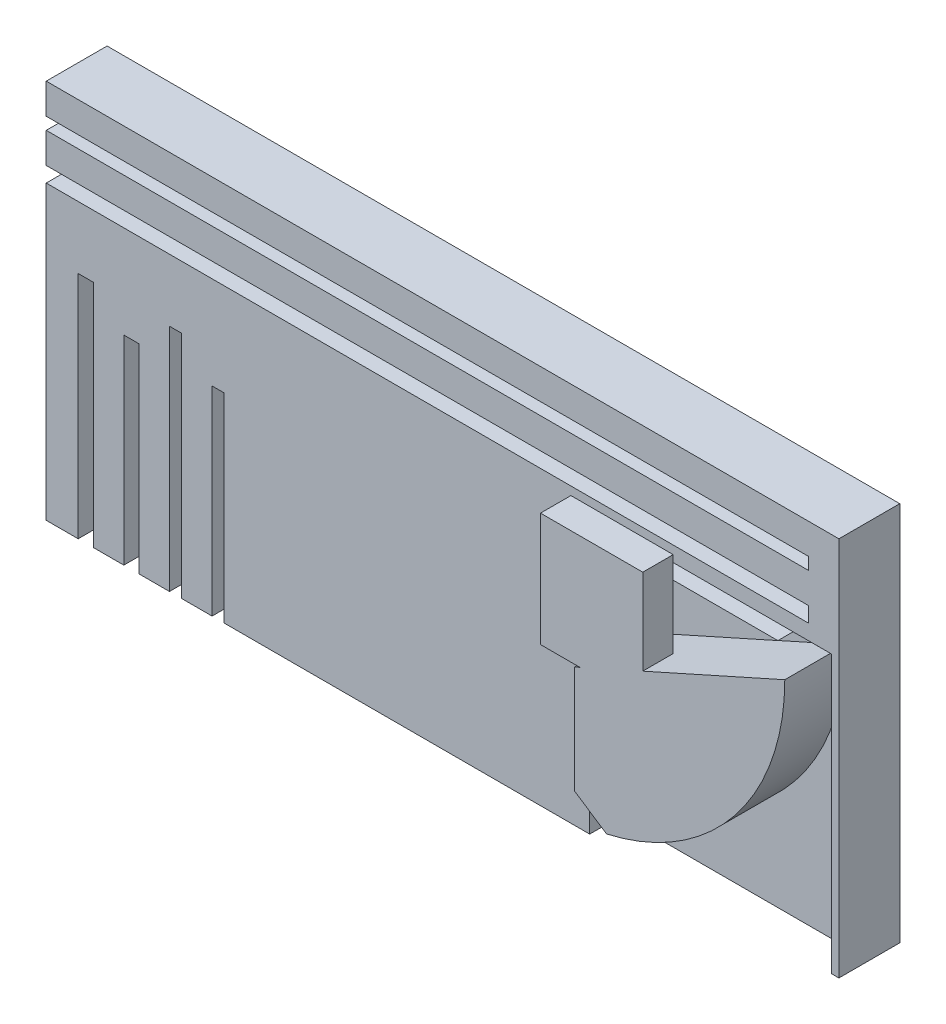
from build123d import *

# Parameters (mm, degrees)
CROQUIS1_W              = 62
CROQUIS1_H              = 25
SALIENTE_EXTRUIR1_DEPTH = 4
CROQUIS2_W              = 1
CROQUIS2_H              = 15.1
CROQUIS2_H_2            = 13.1
CROQUIS2_W_2            = 0.8
CORTAR_EXTRUIR1_DEPTH   = 2
SALIENTE_EXTRUIR7_START = 2
SALIENTE_EXTRUIR7_DEPTH = 2
CROQUIS6_W              = 6.721970081
CROQUIS6_H              = 7.48208129
SALIENTE_EXTRUIR8_DEPTH = 2
CROQUIS7_W              = 9.9
CROQUIS7_H              = 25
CORTAR_EXTRUIR2_DEPTH   = 2


with BuildPart() as part:
    # Croquis1 → Saliente-Extruir1 (new body)
    with BuildSketch(Plane.XY):
        with Locations((-23.290947876, 17.916666667)):
            Rectangle(CROQUIS1_W, CROQUIS1_H)
    extrude(amount=SALIENTE_EXTRUIR1_DEPTH)

    # Croquis2 → Cortar-Extruir1 (cut)
    # profile 1 of 6: a face of its own
    with BuildSketch(Plane.XY.offset(4)):
        Polygon((5.709052124, 25.616666667), (-44.390947876, 25.616666667), (-44.390947876, 27.616666667), (5.709052124, 27.616666667), (5.709052124, 28.416666667), (-44.390947876, 28.416666667), (-44.390947876, 30.416666667), (-54.290947876, 30.416666667), (-54.290947876, 5.416666667), (-44.390947876, 5.416666667), (-44.390947876, 24.616666667), (5.709052124, 24.616666667), align=None)
    # profile 2 of 6: a face of its own
    with BuildSketch(Plane.XY.offset(4)):
        Polygon((7.209052124, 23.616666667), (-8.669899716, 23.616666667), (-8.669899716, 22.207688927), (-8.669899716, 5.416666667), (7.209052124, 5.416666667), align=None)
        with BuildLine():
            Line((6.152295829, 22.616666667), (-7.669899716, 16.428416464))
            Line((-7.669899716, 16.428416464), (-7.669899716, 9.374881416))
            Line((-7.669899716, 9.374881416), (-5.566552681, 7.979930525))
            ThreePointArc((-5.566552681, 7.979930525), (2.861635527, 13.241627263), (6.152295829, 22.616666667))
        make_face(mode=Mode.SUBTRACT)
        Polygon((-7.669899716, 22.616666667), (3.696371878, 22.616666667), (-7.669899716, 17.52794308), align=None, mode=Mode.SUBTRACT)
    # profile 3 of 6: a face of its own
    with BuildSketch(Plane.XY.offset(4)):
        with Locations((-41.790947876, 12.966666667)):
            Rectangle(CROQUIS2_W, CROQUIS2_H)
    # profile 4 of 6: a face of its own
    with BuildSketch(Plane.XY.offset(4)):
        with Locations((-38.790947876, 11.966666667)):
            Rectangle(CROQUIS2_W, CROQUIS2_H_2)
    # profile 5 of 6: a face of its own
    with BuildSketch(Plane.XY.offset(4)):
        with Locations((-35.890947876, 12.966666667)):
            Rectangle(CROQUIS2_W_2, CROQUIS2_H)
    # profile 6 of 6: a face of its own
    with BuildSketch(Plane.XY.offset(4)):
        with Locations((-33.090947876, 11.966666667)):
            Rectangle(CROQUIS2_W_2, CROQUIS2_H_2)
    extrude(amount=-CORTAR_EXTRUIR1_DEPTH, mode=Mode.SUBTRACT)

    # Croquis4 → Saliente-Extruir7 (add)
    with BuildSketch(Plane.XY.offset(4).offset(SALIENTE_EXTRUIR7_START)):
        with BuildLine():
            Line((-5.566552681, 7.979930525), (-7.669899716, 9.374881416))
            Line((-7.669899716, 9.374881416), (-7.669899716, 16.428416464))
            Line((-7.669899716, 16.428416464), (6.152295829, 22.616666667))
            ThreePointArc((6.152295829, 22.616666667), (2.861635527, 13.241627263), (-5.566552681, 7.979930525))
        make_face()
    extrude(amount=-SALIENTE_EXTRUIR7_DEPTH)

    # Croquis6 → Saliente-Extruir8 (add)
    with BuildSketch(Plane.XY.offset(4)):
        with Locations((-6.543986658, 20.329349066)):
            Rectangle(CROQUIS6_W, CROQUIS6_H)
    extrude(amount=SALIENTE_EXTRUIR8_DEPTH)

    # Croquis7 → Cortar-Extruir2 (cut)
    with BuildSketch(Plane.XY.offset(2)):
        with Locations((-49.340947876, 17.916666667)):
            Rectangle(CROQUIS7_W, CROQUIS7_H)
    extrude(amount=-CORTAR_EXTRUIR2_DEPTH, mode=Mode.SUBTRACT)


solid = part.part
